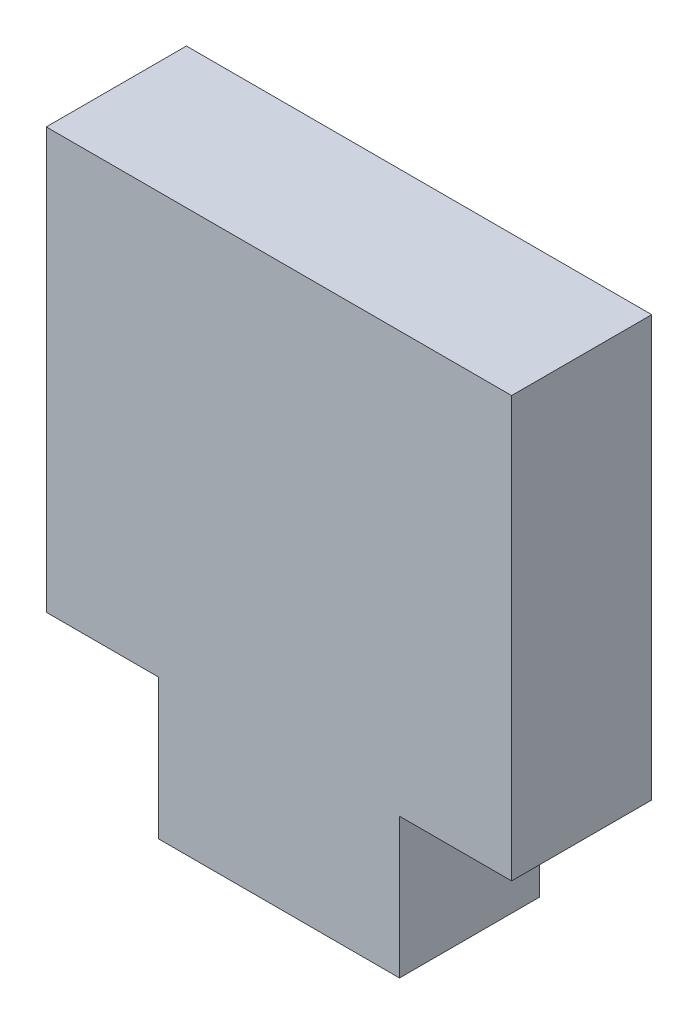
from build123d import *

# Parameters (mm, degrees)
BOSS_EXTRUDE1_DEPTH = 5


with BuildPart() as part:
    # Sketch1 → Boss-Extrude1 (new body)
    with BuildSketch(Plane.XY):
        Polygon((30.689553979, 14.36820834), (22.085253979, 14.36820834), (22.085253979, 19.36820834), (18.085253979, 19.36820834), (18.085253979, 34.36820834), (34.689553979, 34.36820834), (34.689553979, 19.36820834), (30.689553979, 19.36820834), align=None)
    extrude(amount=BOSS_EXTRUDE1_DEPTH)


solid = part.part
